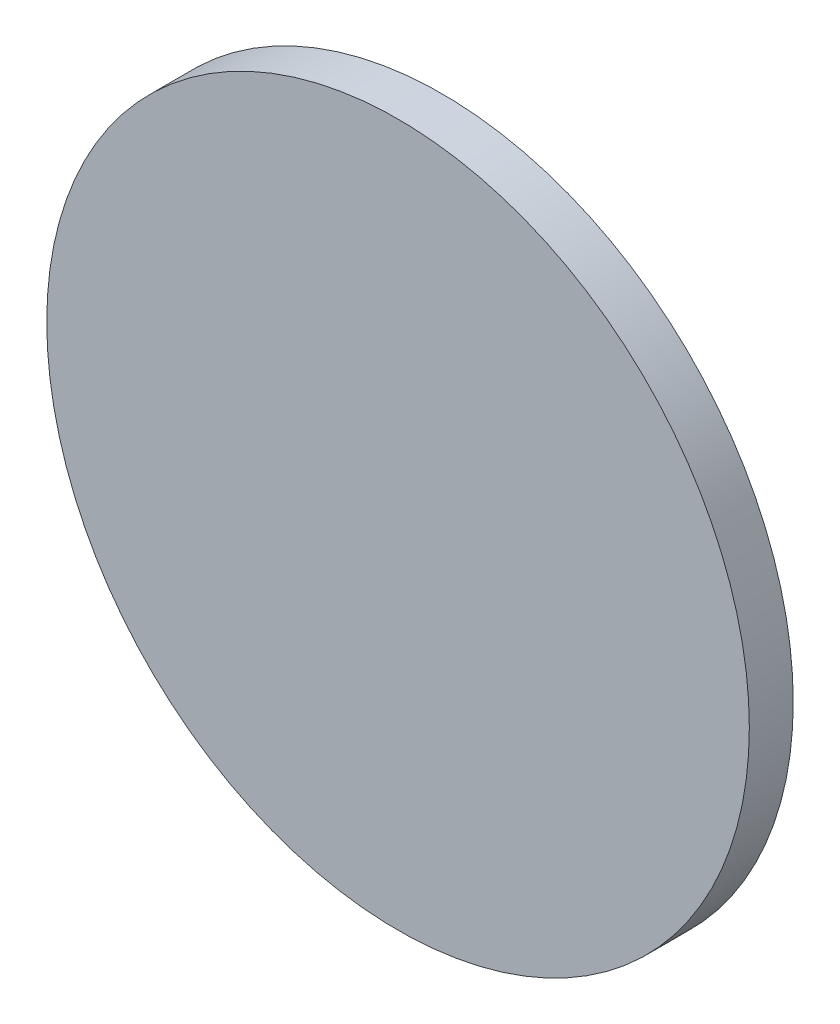
from build123d import *

# Parameters (mm, degrees)
SKETCH1_R           = 4
BOSS_EXTRUDE1_DEPTH = 0.5


with BuildPart() as part:
    # Sketch1 → Boss-Extrude1 (new body)
    with BuildSketch(Plane.XY):
        Circle(SKETCH1_R)
    extrude(amount=-BOSS_EXTRUDE1_DEPTH)


solid = part.part
